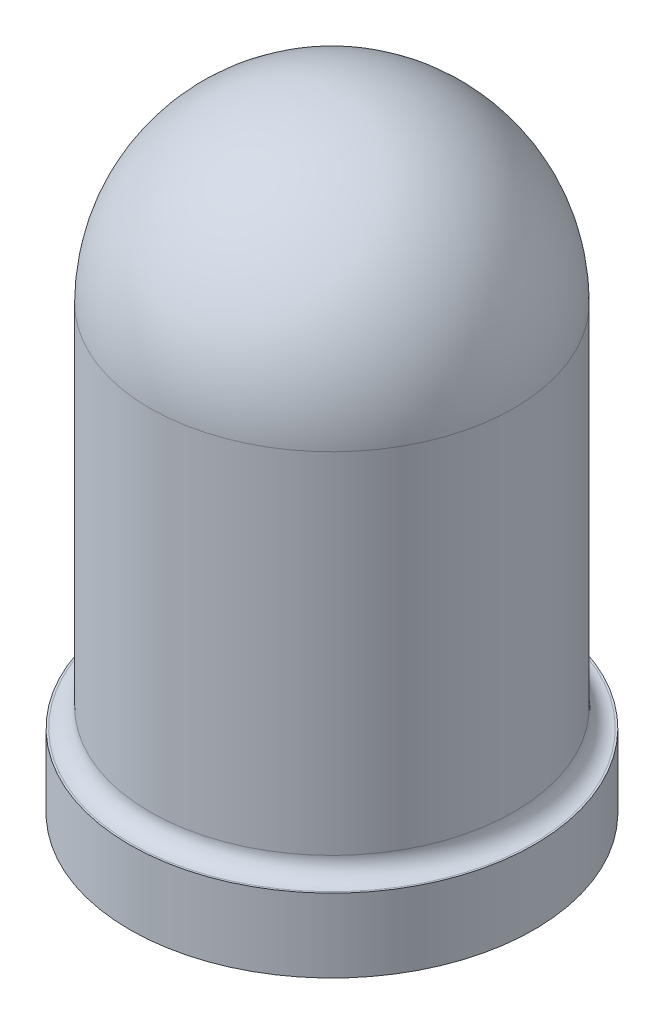
from build123d import *


with BuildPart() as part:
    # Sketch2 → Revolve2 (revolve)
    with BuildSketch(Plane(origin=(0, 0, 0), x_dir=(0, 0, -1), z_dir=(1, 0, 0))):
        with BuildLine():
            Line((-2.475, 6.005), (-2.475, 1.25))
            ThreePointArc((-2.475, 1.25), (-2.548223305, 1.073223305), (-2.725, 1))
            Line((-2.725, 1), (-2.75, 1))
            Line((-2.75, 1), (-2.75, 0))
            Line((-2.75, 0), (0, 0))
            Line((0, 0), (0, 1.67672724))
            Line((0, 1.67672724), (0, 8.48))
            ThreePointArc((0, 8.48), (-1.750089283, 7.755089283), (-2.475, 6.005))
        make_face()
    revolve(axis=Axis((0, 13.171303623, 0), (0, -1, 0)))


solid = part.part
